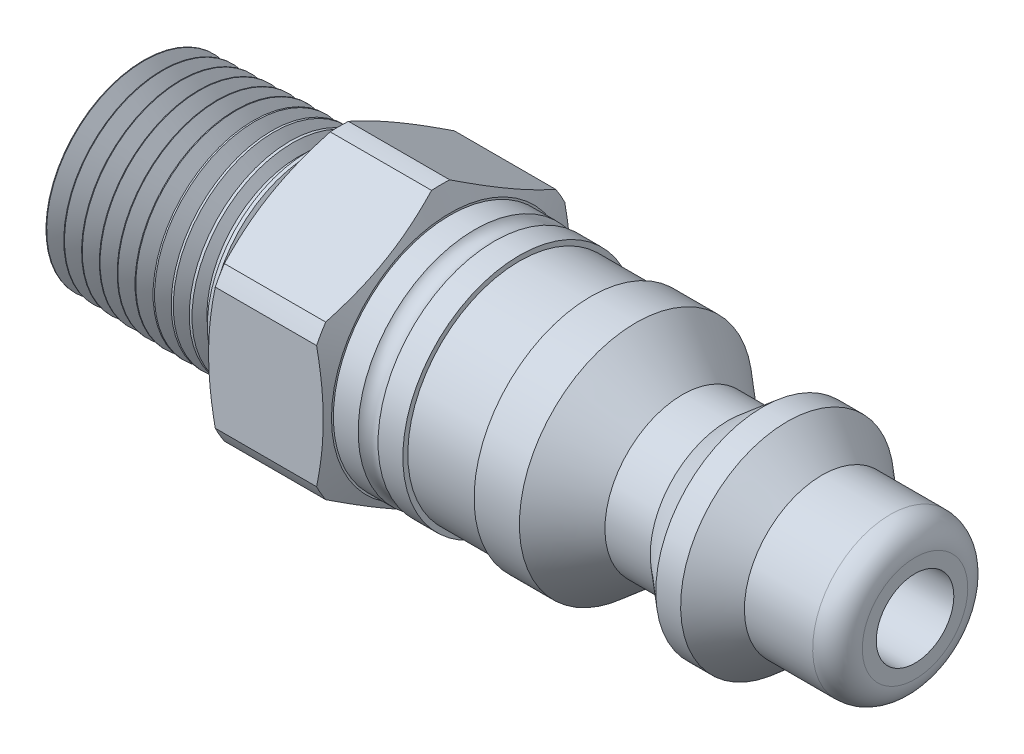
from build123d import *

# Parameters (mm, degrees)
SKETCH6_W      = 11.300333551
SKETCH6_H      = 15.496408613
EXTRUDE1_DEPTH = 6.13324
FILLET1_R      = 1.27


with BuildPart() as part:
    # Sketch1 → Revolve1 (revolve)
    with BuildSketch(Plane.XY):
        Polygon((0, 0), (0, 4.202548436), (0.016953331, 4.234153018), (0.42773912, 4.999944315), (0.463586157, 5.001064591), (0.921387979, 4.262418014), (0.957235016, 4.26353829), (1.368020805, 5.029329586), (1.403867842, 5.030449862), (1.861669664, 4.291803285), (1.897516701, 4.292923561), (2.30830249, 5.058714857), (2.344149527, 5.059835133), (2.801951349, 4.321188556), (2.837798386, 4.322308832), (3.248584175, 5.088100128), (3.284431212, 5.089220404), (3.742233034, 4.350573827), (3.778080071, 4.351694103), (4.18886586, 5.1174854), (4.224712897, 5.118605675), (4.682514719, 4.379959098), (4.718361756, 4.381079374), (5.129147545, 5.146870671), (5.164994582, 5.147990947), (5.622796404, 4.409344369), (5.658643441, 4.410464645), (6.06942923, 5.176255942), (6.105276267, 5.177376218), (6.563078089, 4.43872964), (6.598925126, 4.439849916), (7.009710915, 5.205641213), (7.045557952, 5.206761489), (7.503359774, 4.468114911), (7.539206811, 4.469235187), (7.9499926, 5.235026484), (7.985839637, 5.23614676), (8.443641459, 4.497500182), (8.479488496, 4.498620458), (8.890274285, 5.264411755), (8.926121322, 5.265532031), (9.383923144, 4.526885454), (9.419770181, 4.528005729), (9.83055597, 5.293797026), (9.866403007, 5.294917302), (10.324204829, 4.556270725), (10.360051866, 4.557391001), (10.770837655, 5.323182297), (10.806684692, 5.324302573), (11.264486514, 4.585655996), (11.300333551, 4.586776272), (11.300333551, 0), align=None)
    revolve(axis=Axis((0, 0, 0), (-1, 0, 0)))

    # Sketch5 → Cut-Revolve2 (revolve, cut)
    with BuildSketch(Plane.XY, mode=Mode.PRIVATE) as cut_revolve2_sk:
        Polygon((9.96696, 0), (9.96696, 5.298059865), (11.300333551, 5.339729871), (11.300333551, 0), align=None)
    revolve(cut_revolve2_sk.sketch.rotate(Axis((0, 0, 0), (-1, 0, 0)), 180), axis=Axis((0, 0, 0), (-1, 0, 0)), mode=Mode.SUBTRACT)

    # Sketch6 → Cut-Revolve3 (revolve, cut)
    with BuildSketch(Plane.XY, mode=Mode.PRIVATE) as cut_revolve3_sk:
        with Locations((5.650166776, 12.891704307)):
            Rectangle(SKETCH6_W, SKETCH6_H)
    revolve(cut_revolve3_sk.sketch.rotate(Axis((0, 0, 0), (1, 0, 0)), 180), axis=Axis((0, 0, 0), (1, 0, 0)), mode=Mode.SUBTRACT)

    # Sketch7 → Revolve2 (revolve)
    with BuildSketch(Plane.XY, mode=Mode.PRIVATE) as revolve2_sk:
        Polygon((6.7056, 4.202548436), (9.96696, 5.1435), (9.96696, 4.202548436), align=None)
    revolve(revolve2_sk.sketch.rotate(Axis((0, 0, 0), (1, 0, 0)), 180), axis=Axis((0, 0, 0), (1, 0, 0)))

    # Sketch8 → Extrude1 (add)
    with BuildSketch(Plane(origin=(9.96696, 0, 0), x_dir=(0, 0, -1), z_dir=(1, 0, 0))):
        Polygon((0, 7.332348419), (-6.35, 3.666174209), (-6.35, -3.666174209), (0, -7.332348419), (6.35, -3.666174209), (6.35, 3.666174209), align=None)
    extrude(amount=EXTRUDE1_DEPTH)

    # Sketch9 → Cut-Revolve4 (revolve, cut)
    with BuildSketch(Plane.XY, mode=Mode.PRIVATE) as cut_revolve4_sk:
        Polygon((16.1002, 6.062348419), (15.626431419, 7.078348419), (10.440728581, 7.078348419), (9.96696, 6.062348419), (9.96696, 7.332348419), (16.1002, 7.332348419), align=None)
    revolve(cut_revolve4_sk.sketch.rotate(Axis((0, 0, 0), (1, 0, 0)), 180), axis=Axis((0, 0, 0), (1, 0, 0)), mode=Mode.SUBTRACT)

    # Sketch10 → Revolve3 (revolve)
    with BuildSketch(Plane.XY):
        with BuildLine():
            Line((16.1002, 0), (39.9, 0))
            Line((39.9, 0), (39.9, 3.96875))
            Line((39.9, 3.96875), (35.1375, 3.96875))
            Line((35.1375, 3.96875), (33.362408616, 5.458228526))
            Line((33.362408616, 5.458228526), (32.092408616, 5.458228526))
            Line((32.092408616, 5.458228526), (30.317317232, 3.96875))
            Line((30.317317232, 3.96875), (28.0001, 3.96875))
            Line((28.0001, 3.96875), (25.619597791, 5.966228526))
            Line((25.619597791, 5.966228526), (23.302380559, 5.966228526))
            Line((23.302380559, 5.966228526), (23.302380559, 5.712228526))
            Line((23.302380559, 5.712228526), (19.6562, 5.712228526))
            Line((19.6562, 5.712228526), (19.6562, 5.966228526))
            Line((19.6562, 5.966228526), (18.3862, 5.966228526))
            ThreePointArc((18.3862, 5.966228526), (17.8782, 5.712228526), (17.3702, 5.966228526))
            Line((17.3702, 5.966228526), (16.1002, 5.966228526))
            Line((16.1002, 5.966228526), (16.1002, 0))
        make_face()
    revolve(axis=Axis((0, 0, 0), (-1, 0, 0)))

    # Fillet1
    fillet1_edges = [part.edges().sort_by_distance(p)[0] for p in [
        (39.9, -3.96875, 0),
    ]]
    fillet(fillet1_edges, radius=FILLET1_R)

    # Sketch11 → Cut-Revolve5 (revolve, cut)
    with BuildSketch(Plane.XY, mode=Mode.PRIVATE) as cut_revolve5_sk:
        Polygon((9.96696, 3.4163), (16.1002, 1.984375), (39.9, 1.984375), (39.9, 0), (6.7056, 0), (0, 0), (0, 3.4163), align=None)
    revolve(cut_revolve5_sk.sketch.rotate(Axis((0, 0, 0), (-1, 0, 0)), 180), axis=Axis((0, 0, 0), (-1, 0, 0)), mode=Mode.SUBTRACT)


solid = part.part
